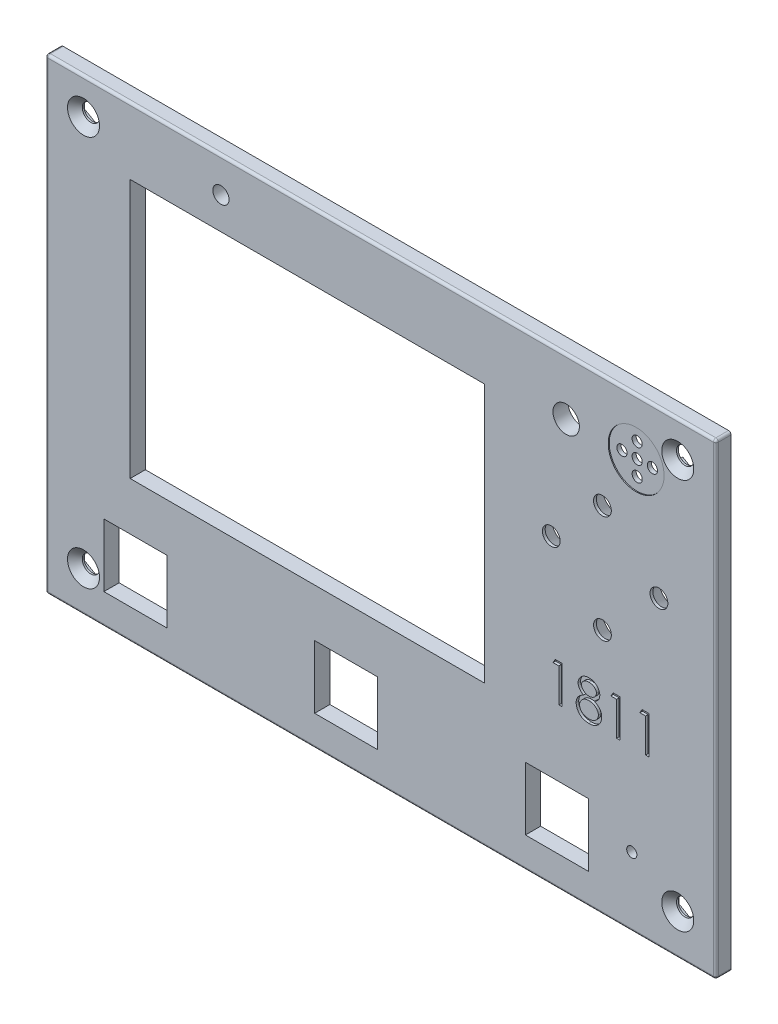
from build123d import *

# Parameters (mm, degrees)
ESQUISSE1_W                                 = 132
ESQUISSE1_H                                 = 92
BOSS_EXTRU_1_DEPTH                          = 3
ESQUISSE2_W                                 = 69.8
ESQUISSE2_H                                 = 51
ENL_V_MAT_EXTRU_1_DEPTH                     = 3
ESQUISSE3_W                                 = 12.4
ESQUISSE3_H                                 = 12.4
ENL_V_MAT_EXTRU_2_DEPTH                     = 3
ESQUISSE5_W                                 = 12.4
ESQUISSE5_H                                 = 12.4
ENL_V_MAT_EXTRU_3_DEPTH                     = 3
ESQUISSE7_R                                 = 1.75
ENL_V_MAT_EXTRU_5_DEPTH                     = 3
ESQUISSE6_W                                 = 12.4
ESQUISSE6_H                                 = 12.4
ENL_V_MAT_EXTRU_6_DEPTH                     = 3
ESQUISSE8_R                                 = 1.6
ENL_V_MAT_EXTRU_7_DEPTH                     = 3
ESQUISSE9_R                                 = 2.6
ENL_V_MAT_EXTRU_8_DEPTH                     = 3
ENL_V_MAT_EXTRU_9_DEPTH                     = 98.437468046
ENL_V_MAT_EXTRU_9_DEPTH_BACK                = 3
ESQUISSE10_R                                = 1
ESQUISSE12_R                                = 5.5
ENL_V_MAT_EXTRU_10_DEPTH                    = 0.2
CONG_1_R                                    = 0.5
CONG_2_R                                    = 0.5
CONG_3_R                                    = 0.5
CONG_4_R                                    = 0.5
ESQUISSE15_R                                = 1.7
ENL_V_MAT_EXTRU_11_DEPTH                    = 3
ESQUISSE20_R                                = 1
ENL_V_MAT_EXTRU_12_DEPTH                    = 3
ESQUISSE23_R                                = 6.5
ENL_V_MAT_EXTRU_13_DEPTH                    = 2
ENL_V_MAT_EXTRU_17_DEPTH                    = 0.5
ESQUISSE25_R                                = 3
ENL_V_MAT_EXTRU_18_DEPTH                    = 3
ENL_V_MAT_EXTRU_18_DRAFT                    = -27
ESQUISSE26_R                                = 3
ENL_V_MAT_EXTRU_19_DEPTH                    = 3
ENL_V_MAT_EXTRU_19_DRAFT                    = -27
ESQUISSE27_R                                = 3
ENL_V_MAT_EXTRU_20_DEPTH                    = 3
ENL_V_MAT_EXTRU_20_DRAFT                    = -27
ESQUISSE28_R                                = 3
ENL_V_MAT_EXTRU_21_DEPTH                    = 3
ENL_V_MAT_EXTRU_21_DRAFT                    = -27
FRAISAGE_POUR_VIS_T_TE_FRAIS_E_M32_AT_COUNT = 2
FRAISAGE_POUR_VIS_T_TE_FRAIS_E_M32_AT_PITCH = 77
FRAISAGE_POUR_VIS_T_TE_FRAIS_E_M32_2_COUNT  = 2
FRAISAGE_POUR_VIS_T_TE_FRAIS_E_M32_2_PITCH  = 140.064270962
FRAISAGE_POUR_VIS_T_TE_FRAIS_E_M32_3_COUNT  = 2
FRAISAGE_POUR_VIS_T_TE_FRAIS_E_M32_3_PITCH  = 117
ENL_V_MAT_EXTRU_22_DEPTH                    = 1.2
ENL_V_MAT_EXTRU_23_DEPTH                    = 1.2
ENL_V_MAT_EXTRU_24_DEPTH                    = 1.2
ENL_V_MAT_EXTRU_25_DEPTH                    = 1.2


with BuildPart() as part:
    # Esquisse1 → Boss.-Extru.1 (new body)
    with BuildSketch(Plane.XY):
        with Locations((13.801143929, 9.828645038)):
            Rectangle(ESQUISSE1_W, ESQUISSE1_H)
    extrude(amount=BOSS_EXTRU_1_DEPTH)

    # Esquisse2 → Enlèv. mat.-Extru.1 (cut)
    with BuildSketch(Plane.XY.offset(3)):
        with Locations((-0.618856071, 17.228645038)):
            Rectangle(ESQUISSE2_W, ESQUISSE2_H)
    extrude(amount=-ENL_V_MAT_EXTRU_1_DEPTH, mode=Mode.SUBTRACT)

    # Esquisse3 → Enlèv. mat.-Extru.2 (cut)
    with BuildSketch(Plane.XY.offset(3)):
        with Locations((-34.488856071, -23.941354962)):
            Rectangle(ESQUISSE3_W, ESQUISSE3_H)
    extrude(amount=-ENL_V_MAT_EXTRU_2_DEPTH, mode=Mode.SUBTRACT)

    # Esquisse5 → Enlèv. mat.-Extru.3 (cut)
    with BuildSketch(Plane.XY.offset(3)):
        with Locations((7.011143929, -23.941354962)):
            Rectangle(ESQUISSE5_W, ESQUISSE5_H)
    extrude(amount=-ENL_V_MAT_EXTRU_3_DEPTH, mode=Mode.SUBTRACT)

    # Esquisse7 → Enlèv. mat.-Extru.5 (cut)
    with BuildSketch(Plane.XY.offset(3)):
        with Locations((57.471143929, 12.398645038)):
            Circle(ESQUISSE7_R)
        with Locations((68.601143929, 23.368645038)):
            Circle(ESQUISSE7_R)
        with Locations((57.471143929, 33.598645038)):
            Circle(ESQUISSE7_R)
        with Locations((47.401143929, 23.368645038)):
            Circle(ESQUISSE7_R)
    extrude(amount=-ENL_V_MAT_EXTRU_5_DEPTH, mode=Mode.SUBTRACT)

    # Esquisse6 → Enlèv. mat.-Extru.6 (cut)
    with BuildSketch(Plane.XY.offset(3)):
        with Locations((48.511143929, -23.941354962)):
            Rectangle(ESQUISSE6_W, ESQUISSE6_H)
    extrude(amount=-ENL_V_MAT_EXTRU_6_DEPTH, mode=Mode.SUBTRACT)

    # Esquisse8 → Enlèv. mat.-Extru.7 (cut)
    with BuildSketch(Plane.XY.offset(3)):
        with Locations((-17.648856071, 49.018645038)):
            Circle(ESQUISSE8_R)
    extrude(amount=-ENL_V_MAT_EXTRU_7_DEPTH, mode=Mode.SUBTRACT)

    # Esquisse9 → Enlèv. mat.-Extru.8 (cut)
    with BuildSketch(Plane.XY.offset(3)):
        with Locations((50.331143929, 44.768645038)):
            Circle(ESQUISSE9_R)
    extrude(amount=-ENL_V_MAT_EXTRU_8_DEPTH, mode=Mode.SUBTRACT)

    # Esquisse10 → Enlèv. mat.-Extru.9 (cut, two sides: drawn at the far end of the back side and taken through both)
    with BuildSketch(Plane.XY.offset(3).offset(-ENL_V_MAT_EXTRU_9_DEPTH_BACK)):
        with Locations(Location((64.111143929, 44.768645038, 0), (0, 0, 180))):
            Circle(ESQUISSE10_R)
        with Locations(Location((64.111143929, 47.768645038, 0), (0, 0, 180))):
            Circle(ESQUISSE10_R)
        with Locations(Location((64.111143929, 41.768645038, 0), (0, 0, 180))):
            Circle(ESQUISSE10_R)
        with Locations(Location((61.111143929, 44.768645038, 0), (0, 0, 180))):
            Circle(ESQUISSE10_R)
        with Locations(Location((67.111143929, 44.768645038, 0), (0, 0, 180))):
            Circle(ESQUISSE10_R)
    extrude(amount=ENL_V_MAT_EXTRU_9_DEPTH + ENL_V_MAT_EXTRU_9_DEPTH_BACK, mode=Mode.SUBTRACT)

    # Esquisse12 → Enlèv. mat.-Extru.10 (cut)
    with BuildSketch(Plane.XY.offset(3)):
        with Locations((64.111143929, 44.768645038)):
            Circle(ESQUISSE12_R)
    extrude(amount=-ENL_V_MAT_EXTRU_10_DEPTH, mode=Mode.SUBTRACT)

    # Congé1
    cong_1_edges = [part.edges().sort_by_distance(p)[0] for p in [
        (-52.198856071, 9.828645038, 3),
    ]]
    fillet(cong_1_edges, radius=CONG_1_R)

    # Congé2
    cong_2_edges = [part.edges().sort_by_distance(p)[0] for p in [
        (14.051143929, -36.171354962, 3),
        (-52.198856071, -36.171354962, 1.25),
        (-52.052409461, -36.171354962, 2.853553391),
    ]]
    fillet(cong_2_edges, radius=CONG_2_R)

    # Congé3
    cong_3_edges = [part.edges().sort_by_distance(p)[0] for p in [
        (79.801143929, -36.171354962, 1.25),
        (79.801143929, 10.078645038, 3),
        (79.801143929, -36.024908352, 2.853553391),
    ]]
    fillet(cong_3_edges, radius=CONG_3_R)

    # Congé4
    cong_4_edges = [part.edges().sort_by_distance(p)[0] for p in [
        (-52.198856071, 55.828645038, 1.25),
        (-52.052409461, 55.828645038, 2.853553391),
        (79.801143929, 55.828645038, 1.25),
        (13.801143929, 55.828645038, 3),
        (79.65469732, 55.828645038, 2.853553391),
    ]]
    fillet(cong_4_edges, radius=CONG_4_R)

    # Esquisse15 → Enlèv. mat.-Extru.11 (cut)
    with BuildSketch(Plane.XY.offset(3)):
        with Locations((-44.698856071, 48.828645038)):
            Circle(ESQUISSE15_R)
        with Locations((72.301143929, 48.828645038)):
            Circle(ESQUISSE15_R)
        with Locations((-44.698856071, -28.171354962)):
            Circle(ESQUISSE15_R)
        with Locations((72.301143929, -28.171354962)):
            Circle(ESQUISSE15_R)
    extrude(amount=-ENL_V_MAT_EXTRU_11_DEPTH, mode=Mode.SUBTRACT)

    # Esquisse20 → Enlèv. mat.-Extru.12 (cut)
    with BuildSketch(Plane.XY.offset(3)):
        with Locations((63.251143929, -22.583354962)):
            Circle(ESQUISSE20_R)
    extrude(amount=-ENL_V_MAT_EXTRU_12_DEPTH, mode=Mode.SUBTRACT)

    # Esquisse23 → Enlèv. mat.-Extru.13 (cut)
    with BuildSketch(Plane(origin=(0, 0, 0), x_dir=(-1, 0, 0), z_dir=(0, 0, -1))):
        with Locations((-64.111143929, 44.768645038)):
            Circle(ESQUISSE23_R)
    extrude(amount=-ENL_V_MAT_EXTRU_13_DEPTH, mode=Mode.SUBTRACT)

    # Esquisse24 → Enlèv. mat.-Extru.17 (cut)
    # profile 1 of 4: a face of its own
    with BuildSketch(Plane.XY.offset(3)):
        Polygon((48.176182968, 2.733677062), (49.545952933, 2.733677062), (49.545952933, -4.674656271), (48.881102506, -4.674656271), (48.881102506, 1.973848002), (47.741358916, 1.973848002), align=None)
    # profile 2 of 4: a face of its own
    with BuildSketch(Plane.XY.offset(3)):
        with BuildLine():
            add(Edge.make_bspline(
                [(55.902101104, -0.547537882), (55.962740529, -0.579156555), (56.081007658, -0.640823528), (56.249446082, -0.740118113), (56.403380668, -0.844768156), (56.547082358, -0.949830725), (56.67802645, -1.059329387), (56.794748791, -1.173699568), (56.900132586, -1.290086485), (56.992052612, -1.41046098), (57.072902583, -1.534503254), (57.14277827, -1.662538882), (57.202504682, -1.794287272), (57.249839569, -1.931186562), (57.288832362, -2.071225782), (57.315662392, -2.216213177), (57.330091535, -2.365193366), (57.332819523, -2.465879604), (57.334200797, -2.516860465)],
                knots=[0, 0, 0, 0, 1.272397273, 2.481599622, 3.635517121, 4.734568067, 5.792894095, 6.808321871, 7.773003508, 8.711915296, 9.623354172, 10.525449501, 11.423591555, 12.311487226, 13.218079475, 14.126165749, 15.051214107, 16, 16, 16, 16], degree=3))
            add(Edge.make_bspline(
                [(57.334200797, -2.516860465), (57.332567956, -2.588187332), (57.329335953, -2.729369966), (57.30118432, -2.937747568), (57.259035182, -3.14012584), (57.197483548, -3.336460412), (57.117656871, -3.525667919), (57.019280901, -3.707910323), (56.907920517, -3.886174527), (56.818486611, -3.995858928), (56.773233248, -4.051358996)],
                knots=[0, 0, 0, 0, 1.025265484, 2.029385089, 3.018602448, 3.995076438, 4.983346944, 5.966715145, 6.97116228, 8, 8, 8, 8], degree=3))
            add(Edge.make_bspline(
                [(56.773233248, -4.051358996), (56.714312711, -4.116115818), (56.597199734, -4.244829244), (56.396575871, -4.411941792), (56.176396217, -4.552381342), (55.937512746, -4.666833519), (55.680564014, -4.755915254), (55.405604771, -4.819928584), (55.112098981, -4.856594392), (54.910369067, -4.861894504), (54.806878748, -4.864613536)],
                knots=[0, 0, 0, 0, 0.954267603, 1.896743057, 2.838368354, 3.796610408, 4.779680527, 5.799409237, 6.871065594, 8, 8, 8, 8], degree=3))
            add(Edge.make_bspline(
                [(54.806878748, -4.864613536), (54.707367075, -4.862174125), (54.513727468, -4.857427277), (54.231876627, -4.82526573), (53.969149463, -4.768903413), (53.724018363, -4.691762323), (53.497961129, -4.591410673), (53.291621898, -4.466509541), (53.102023657, -4.322086322), (52.934920288, -4.15399319), (52.786566415, -3.973954027), (52.656247369, -3.788213119), (52.547928903, -3.596753512), (52.456219885, -3.402430035), (52.386014237, -3.202519009), (52.337389725, -2.998048981), (52.30650901, -2.789377096), (52.302400275, -2.648551763), (52.300333275, -2.577706151)],
                knots=[0, 0, 0, 0, 1.256902934, 2.445805442, 3.576955095, 4.645999104, 5.686449165, 6.692658513, 7.68621702, 8.689161843, 9.678783111, 10.630372946, 11.551080876, 12.453998257, 13.34127905, 14.221779781, 15.105423033, 16, 16, 16, 16], degree=3))
            add(Edge.make_bspline(
                [(52.300333275, -2.577706151), (52.301556457, -2.525722528), (52.303973895, -2.422984541), (52.320705824, -2.271199796), (52.3476054, -2.123464644), (52.384137917, -1.979233403), (52.433648923, -1.839556109), (52.493428105, -1.70377094), (52.563134071, -1.571724597), (52.643739204, -1.442694966), (52.737511821, -1.318489998), (52.843691547, -1.19700181), (52.964400535, -1.080115524), (53.098295913, -0.966403058), (53.243847522, -0.853847247), (53.404835961, -0.748530955), (53.576993495, -0.642998263), (53.69934827, -0.579903974), (53.762113791, -0.547537882)],
                knots=[0, 0, 0, 0, 0.941657376, 1.861047343, 2.762797495, 3.66048619, 4.553285746, 5.444104102, 6.34607688, 7.256116206, 8.197091036, 9.162375105, 10.176350973, 11.237807142, 12.343728897, 13.50695164, 14.721116704, 16, 16, 16, 16], degree=3))
            add(Edge.make_bspline(
                [(53.762113791, -0.547537882), (53.676195381, -0.500685955), (53.509833291, -0.409967511), (53.289552974, -0.243286771), (53.100342821, -0.062760896), (52.947403669, 0.135422169), (52.827024119, 0.345071387), (52.74443474, 0.564875054), (52.688562182, 0.790757494), (52.683027465, 0.94507561), (52.680247805, 1.022577636)],
                knots=[0, 0, 0, 0, 1.166880483, 2.259407225, 3.286803203, 4.280235371, 5.237608625, 6.161067461, 7.076446754, 8, 8, 8, 8], degree=3))
            add(Edge.make_bspline(
                [(52.680247805, 1.022577636), (52.683709453, 1.101524135), (52.690667968, 1.260220365), (52.746935997, 1.496453326), (52.838630138, 1.728475055), (52.963346248, 1.955160981), (53.118682522, 2.168838935), (53.305047711, 2.360483938), (53.517991356, 2.528359909), (53.756450508, 2.669279475), (54.013067207, 2.783968219), (54.283822155, 2.863085881), (54.563997899, 2.914808995), (54.754704739, 2.92066508), (54.851399982, 2.923634327)],
                knots=[0, 0, 0, 0, 0.888701115, 1.786444228, 2.72001202, 3.692817113, 4.693886446, 5.687152267, 6.695133018, 7.739871481, 8.800368666, 9.853104506, 10.91144658, 12, 12, 12, 12], degree=3))
            add(Edge.make_bspline(
                [(54.851399982, 2.923634327), (54.945599724, 2.920572901), (55.131350883, 2.914536117), (55.404389511, 2.864187225), (55.665638835, 2.780093075), (55.914197941, 2.666010619), (56.145617061, 2.525491594), (56.350091949, 2.355309744), (56.53071258, 2.164510128), (56.680116215, 1.950896968), (56.803227664, 1.725082091), (56.888954572, 1.488814422), (56.94388625, 1.247198914), (56.950814871, 1.083711806), (56.954286267, 1.00180106)],
                knots=[0, 0, 0, 0, 1.072916533, 2.115669174, 3.151510826, 4.193348718, 5.225979165, 6.227137561, 7.216255879, 8.211077061, 9.189680878, 10.138522389, 11.067357538, 12, 12, 12, 12], degree=3))
            add(Edge.make_bspline(
                [(56.954286267, 1.00180106), (56.95124978, 0.921417122), (56.945286293, 0.763547635), (56.895121421, 0.533409834), (56.81063824, 0.317886518), (56.695292262, 0.114532103), (56.54495498, -0.072965401), (56.361633162, -0.246990262), (56.146788366, -0.408972049), (55.98536949, -0.500383186), (55.902101104, -0.547537882)],
                knots=[0, 0, 0, 0, 0.975232327, 1.915300861, 2.843280834, 3.77672583, 4.742871857, 5.749627742, 6.839139064, 8, 8, 8, 8], degree=3))
        make_face()
        with BuildLine():
            add(Edge.make_bspline(
                [(54.814298954, 2.163805267), (54.762333081, 2.162426385), (54.660665113, 2.159728688), (54.511591092, 2.145634573), (54.369832915, 2.11821693), (54.23390947, 2.081728324), (54.105684317, 2.032435416), (53.98341601, 1.974449313), (53.869185458, 1.903951474), (53.7616137, 1.824870272), (53.664774561, 1.737890288), (53.57882826, 1.647267916), (53.507437085, 1.551223336), (53.446813403, 1.452145642), (53.402825858, 1.347094255), (53.369881415, 1.239289932), (53.347611136, 1.127370369), (53.345942377, 1.050881422), (53.345098232, 1.012189348)],
                knots=[0, 0, 0, 0, 1.203892937, 2.355340988, 3.463153438, 4.544400666, 5.610487187, 6.640501085, 7.674077295, 8.714426146, 9.728707835, 10.68524104, 11.601827946, 12.495867327, 13.368432065, 14.231010473, 15.105153427, 16, 16, 16, 16], degree=3))
            add(Edge.make_bspline(
                [(53.345098232, 1.012189348), (53.346553159, 0.973495603), (53.349428303, 0.897031204), (53.371664157, 0.784115788), (53.4048045, 0.673156657), (53.456981733, 0.566792228), (53.519563859, 0.461332785), (53.59680415, 0.359414044), (53.688855925, 0.260681313), (53.792630674, 0.165974362), (53.905685096, 0.077288647), (54.025454654, 0.000298746), (54.150436182, -0.064120121), (54.279345562, -0.117734028), (54.413496609, -0.159411062), (54.552067311, -0.18897803), (54.695080958, -0.207354923), (54.791983187, -0.209549952), (54.841011694, -0.210660545)],
                knots=[0, 0, 0, 0, 0.873023192, 1.725219244, 2.590779336, 3.480155217, 4.391973325, 5.357036234, 6.360879153, 7.436073238, 8.526419356, 9.601555421, 10.645666583, 11.697338044, 12.750135903, 13.812665442, 14.89329948, 16, 16, 16, 16], degree=3))
            add(Edge.make_bspline(
                [(54.841011694, -0.210660545), (54.903982747, -0.208812976), (55.029302892, -0.205136087), (55.214044144, -0.170949436), (55.393670074, -0.117173577), (55.566260755, -0.043598315), (55.727348794, 0.048747322), (55.870943605, 0.15930721), (55.995820362, 0.285528483), (56.10068132, 0.425446152), (56.181982162, 0.574357014), (56.245274322, 0.7237943), (56.282233894, 0.875352356), (56.287054744, 0.976882429), (56.289435839, 1.02702976)],
                knots=[0, 0, 0, 0, 1.076279235, 2.141928126, 3.20205304, 4.278698113, 5.344010996, 6.36967002, 7.368914609, 8.37248503, 9.349703398, 10.264243087, 11.142681841, 12, 12, 12, 12], degree=3))
            add(Edge.make_bspline(
                [(56.289435839, 1.02702976), (56.288309989, 1.062225769), (56.286075339, 1.132084803), (56.26766022, 1.235247676), (56.237231374, 1.336063628), (56.196034521, 1.435365501), (56.141827122, 1.53176005), (56.077556259, 1.626762587), (55.999484064, 1.718235953), (55.911861613, 1.808311865), (55.812493832, 1.891674715), (55.701572217, 1.964984851), (55.579665446, 2.027241006), (55.446770635, 2.077805537), (55.303377212, 2.11578351), (55.150145628, 2.14422378), (54.985798215, 2.160253532), (54.872705242, 2.162595678), (54.814298954, 2.163805267)],
                knots=[0, 0, 0, 0, 0.814439003, 1.616544685, 2.417341072, 3.248991801, 4.09997495, 4.973547432, 5.9003056, 6.880240646, 7.880314356, 8.896779544, 9.951930927, 11.043077905, 12.18215768, 13.381699519, 14.647792085, 16, 16, 16, 16], degree=3))
        make_face(mode=Mode.SUBTRACT)
        with BuildLine():
            add(Edge.make_bspline(
                [(54.857336146, -0.970489605), (54.791453234, -0.971661479), (54.662207035, -0.97396041), (54.472856537, -0.999549853), (54.291134003, -1.035172068), (54.117652137, -1.089212343), (53.952484199, -1.159478247), (53.794736054, -1.244006357), (53.645614497, -1.343924545), (53.507178726, -1.457963381), (53.380764345, -1.580855892), (53.26985461, -1.710950745), (53.175668192, -1.845830106), (53.099821144, -1.987206991), (53.037566312, -2.132087767), (52.996685271, -2.284080511), (52.970477315, -2.440263234), (52.966958078, -2.546435442), (52.965183703, -2.599966768)],
                knots=[0, 0, 0, 0, 1.140299081, 2.23698856, 3.303958914, 4.344563908, 5.37730929, 6.408454204, 7.439741482, 8.480804886, 9.510774543, 10.48932336, 11.43758569, 12.353841022, 13.263987381, 14.161954604, 15.073269652, 16, 16, 16, 16], degree=3))
            add(Edge.make_bspline(
                [(52.965183703, -2.599966768), (52.968069267, -2.666495519), (52.973794159, -2.798487008), (53.019210711, -2.993565508), (53.092099262, -3.182416741), (53.193752635, -3.363501708), (53.319625664, -3.532729433), (53.474410021, -3.680237341), (53.648486461, -3.811304471), (53.847744919, -3.917308267), (54.065398505, -4.001964043), (54.301389331, -4.060290831), (54.552330576, -4.0989019), (54.725600046, -4.102792716), (54.814298954, -4.104784476)],
                knots=[0, 0, 0, 0, 0.898778495, 1.783155532, 2.693654817, 3.627872908, 4.583023416, 5.533784346, 6.509005473, 7.520592997, 8.575161974, 9.658835044, 10.801527049, 12, 12, 12, 12], degree=3))
            add(Edge.make_bspline(
                [(54.814298954, -4.104784476), (54.883620566, -4.103453499), (55.018681296, -4.100860327), (55.215713221, -4.077970071), (55.401650849, -4.041670032), (55.576133606, -3.98887286), (55.741114733, -3.924420409), (55.893796999, -3.84150617), (56.038108215, -3.747203753), (56.166937275, -3.635320655), (56.2842709, -3.515772391), (56.386576369, -3.3892168), (56.475386519, -3.259093378), (56.545090375, -3.122461519), (56.600814279, -2.98194255), (56.640869137, -2.836240718), (56.665583792, -2.684909141), (56.668083355, -2.582252774), (56.669350369, -2.530216835)],
                knots=[0, 0, 0, 0, 1.224942928, 2.386581632, 3.501229538, 4.569074225, 5.605009692, 6.626002462, 7.634866581, 8.645888296, 9.63523824, 10.59253846, 11.518950513, 12.414518923, 13.29783783, 14.186679152, 15.080837789, 16, 16, 16, 16], degree=3))
            add(Edge.make_bspline(
                [(56.669350369, -2.530216835), (56.66743299, -2.479676464), (56.663652253, -2.380019681), (56.639656256, -2.2323472), (56.597500983, -2.08967791), (56.539657993, -1.950295397), (56.462651622, -1.817023818), (56.371963313, -1.686391255), (56.262544096, -1.562023448), (56.1389041, -1.442954394), (56.0041593, -1.332854418), (55.86093051, -1.23545719), (55.710320232, -1.153431877), (55.552647169, -1.086721962), (55.388261426, -1.034255151), (55.217283911, -0.997602961), (55.039514445, -0.974532135), (54.918748301, -0.971852338), (54.857336146, -0.970489605)],
                knots=[0, 0, 0, 0, 0.917430815, 1.809013306, 2.70690318, 3.612392954, 4.541220862, 5.495268465, 6.494511384, 7.542276156, 8.608045339, 9.649016899, 10.681629292, 11.715607085, 12.752076957, 13.808767841, 14.885711793, 16, 16, 16, 16], degree=3))
        make_face(mode=Mode.SUBTRACT)
    # profile 3 of 4: a face of its own
    with BuildSketch(Plane.XY.offset(3)):
        Polygon((59.573618865, 2.733677062), (60.943388831, 2.733677062), (60.943388831, -4.674656271), (60.278538403, -4.674656271), (60.278538403, 1.973848002), (59.138794814, 1.973848002), align=None)
    # profile 4 of 4: a face of its own
    with BuildSketch(Plane.XY.offset(3)):
        Polygon((65.272336814, 2.733677062), (66.642106779, 2.733677062), (66.642106779, -4.674656271), (65.977256352, -4.674656271), (65.977256352, 1.973848002), (64.837512762, 1.973848002), align=None)
    extrude(amount=-ENL_V_MAT_EXTRU_17_DEPTH, mode=Mode.SUBTRACT)


with BuildPart() as enl_v_mat_extru_18_tool:
    # Esquisse25 → Enlèv. mat.-Extru.18 (with draft: the straight prism first)
    with BuildSketch(Plane(origin=(0, 0, 0), x_dir=(-1, 0, 0), z_dir=(0, 0, -1))):
        with Locations((-47.401143929, 23.368645038)):
            Circle(ESQUISSE25_R)
    extrude(amount=-ENL_V_MAT_EXTRU_18_DEPTH)
    # Enlèv. mat.-Extru.18: the draft: its side faces are tilted about the plane it starts from
    enl_v_mat_extru_18_sides = [enl_v_mat_extru_18_tool.faces().sort_by_distance(p)[0] for p in [
        (50.401143929, 23.368645038, 1.5),
    ]]
    draft(enl_v_mat_extru_18_sides, Plane(origin=(0, 0, 0), x_dir=(-1, 0, 0), z_dir=(0, 0, -1)), ENL_V_MAT_EXTRU_18_DRAFT)


with BuildPart() as part_1:
    add(part.part)

    # Enlèv. mat.-Extru.18: cut by enl_v_mat_extru_18_tool
    add(enl_v_mat_extru_18_tool.part, mode=Mode.SUBTRACT)


with BuildPart() as enl_v_mat_extru_19_tool:
    # Esquisse26 → Enlèv. mat.-Extru.19 (with draft: the straight prism first)
    with BuildSketch(Plane(origin=(0, 0, 0), x_dir=(-1, 0, 0), z_dir=(0, 0, -1))):
        with Locations((-57.471143929, 12.398645038)):
            Circle(ESQUISSE26_R)
    extrude(amount=-ENL_V_MAT_EXTRU_19_DEPTH)
    # Enlèv. mat.-Extru.19: the draft: its side faces are tilted about the plane it starts from
    enl_v_mat_extru_19_sides = [enl_v_mat_extru_19_tool.faces().sort_by_distance(p)[0] for p in [
        (60.471143929, 12.398645038, 1.5),
    ]]
    draft(enl_v_mat_extru_19_sides, Plane(origin=(0, 0, 0), x_dir=(-1, 0, 0), z_dir=(0, 0, -1)), ENL_V_MAT_EXTRU_19_DRAFT)


with BuildPart() as part_2:
    add(part_1.part)

    # Enlèv. mat.-Extru.19: cut by enl_v_mat_extru_19_tool
    add(enl_v_mat_extru_19_tool.part, mode=Mode.SUBTRACT)


with BuildPart() as enl_v_mat_extru_20_tool:
    # Esquisse27 → Enlèv. mat.-Extru.20 (with draft: the straight prism first)
    with BuildSketch(Plane(origin=(0, 0, 0), x_dir=(-1, 0, 0), z_dir=(0, 0, -1))):
        with Locations((-68.601143929, 23.368645038)):
            Circle(ESQUISSE27_R)
    extrude(amount=-ENL_V_MAT_EXTRU_20_DEPTH)
    # Enlèv. mat.-Extru.20: the draft: its side faces are tilted about the plane it starts from
    enl_v_mat_extru_20_sides = [enl_v_mat_extru_20_tool.faces().sort_by_distance(p)[0] for p in [
        (71.601143929, 23.368645038, 1.5),
    ]]
    draft(enl_v_mat_extru_20_sides, Plane(origin=(0, 0, 0), x_dir=(-1, 0, 0), z_dir=(0, 0, -1)), ENL_V_MAT_EXTRU_20_DRAFT)


with BuildPart() as part_3:
    add(part_2.part)

    # Enlèv. mat.-Extru.20: cut by enl_v_mat_extru_20_tool
    add(enl_v_mat_extru_20_tool.part, mode=Mode.SUBTRACT)


with BuildPart() as enl_v_mat_extru_21_tool:
    # Esquisse28 → Enlèv. mat.-Extru.21 (with draft: the straight prism first)
    with BuildSketch(Plane(origin=(0, 0, 0), x_dir=(-1, 0, 0), z_dir=(0, 0, -1))):
        with Locations((-57.471143929, 33.598645038)):
            Circle(ESQUISSE28_R)
    extrude(amount=-ENL_V_MAT_EXTRU_21_DEPTH)
    # Enlèv. mat.-Extru.21: the draft: its side faces are tilted about the plane it starts from
    enl_v_mat_extru_21_sides = [enl_v_mat_extru_21_tool.faces().sort_by_distance(p)[0] for p in [
        (60.471143929, 33.598645038, 1.5),
    ]]
    draft(enl_v_mat_extru_21_sides, Plane(origin=(0, 0, 0), x_dir=(-1, 0, 0), z_dir=(0, 0, -1)), ENL_V_MAT_EXTRU_21_DRAFT)


with BuildPart() as part_4:
    add(part_3.part)

    # Enlèv. mat.-Extru.21: cut by enl_v_mat_extru_21_tool
    add(enl_v_mat_extru_21_tool.part, mode=Mode.SUBTRACT)

    # Esquisse32 → Fraisage pour vis à tête fraisée M32 (revolve, cut)
    with BuildSketch(Plane(origin=(-44.698856071, 48.828645038, 3), x_dir=(0, -1, 0), z_dir=(1, 0, 0))):
        Polygon((0, 0), (0, 3), (1.7, 3), (1.7, 1.45), (3.15, 0), align=None)
    fraisage_pour_vis_t_te_frais_e_m32 = revolve(axis=Axis((-44.698856071, 48.828645038, 9.35), (0, 0, -1)), mode=Mode.SUBTRACT)

    # Fraisage pour vis à tête fraisée M32 at: Fraisage pour vis à tête fraisée M32 ×2
    with Locations(*[(0, -i * FRAISAGE_POUR_VIS_T_TE_FRAIS_E_M32_AT_PITCH, 0) for i in range(1, FRAISAGE_POUR_VIS_T_TE_FRAIS_E_M32_AT_COUNT)]):
        add(fraisage_pour_vis_t_te_frais_e_m32, mode=Mode.SUBTRACT)

    # Fraisage pour vis _ t_te frais_e M32 2: Fraisage pour vis à tête fraisée M32 ×2
    with Locations(*[Vector(0.8353308034715732, -0.5497476227975308, 0) * (i * FRAISAGE_POUR_VIS_T_TE_FRAIS_E_M32_2_PITCH) for i in range(1, FRAISAGE_POUR_VIS_T_TE_FRAIS_E_M32_2_COUNT)]):
        add(fraisage_pour_vis_t_te_frais_e_m32, mode=Mode.SUBTRACT)

    # Fraisage pour vis _ t_te frais_e M32 3: Fraisage pour vis à tête fraisée M32 ×2
    with Locations(*[(i * FRAISAGE_POUR_VIS_T_TE_FRAIS_E_M32_3_PITCH, 0, 0) for i in range(1, FRAISAGE_POUR_VIS_T_TE_FRAIS_E_M32_3_COUNT)]):
        add(fraisage_pour_vis_t_te_frais_e_m32, mode=Mode.SUBTRACT)

    # Esquisse33 → Enlèv. mat.-Extru.22 (cut)
    with BuildSketch(Plane(origin=(0, 0, 0), x_dir=(-1, 0, 0), z_dir=(0, 0, -1))):
        Polygon((44.698856071, -24.971354962), (41.927574779, -26.571354962), (41.927574779, -29.771354962), (44.698856071, -31.371354962), (47.470137363, -29.771354962), (47.470137363, -26.571354962), align=None)
    extrude(amount=-ENL_V_MAT_EXTRU_22_DEPTH, mode=Mode.SUBTRACT)

    # Esquisse34 → Enlèv. mat.-Extru.23 (cut)
    with BuildSketch(Plane(origin=(0, 0, 0), x_dir=(-1, 0, 0), z_dir=(0, 0, -1))):
        Polygon((44.698856071, 52.028645038), (41.927574779, 50.428645038), (41.927574779, 47.228645038), (44.698856071, 45.628645038), (47.470137363, 47.228645038), (47.470137363, 50.428645038), align=None)
    extrude(amount=-ENL_V_MAT_EXTRU_23_DEPTH, mode=Mode.SUBTRACT)

    # Esquisse35 → Enlèv. mat.-Extru.24 (cut)
    with BuildSketch(Plane(origin=(0, 0, 0), x_dir=(-1, 0, 0), z_dir=(0, 0, -1))):
        Polygon((-72.301143929, 52.028645038), (-75.072425221, 50.428645038), (-75.072425221, 47.228645038), (-72.301143929, 45.628645038), (-69.529862637, 47.228645038), (-69.529862637, 50.428645038), align=None)
    extrude(amount=-ENL_V_MAT_EXTRU_24_DEPTH, mode=Mode.SUBTRACT)

    # Esquisse36 → Enlèv. mat.-Extru.25 (cut)
    with BuildSketch(Plane(origin=(0, 0, 0), x_dir=(-1, 0, 0), z_dir=(0, 0, -1))):
        Polygon((-72.301143929, -24.971354962), (-75.072425221, -26.571354962), (-75.072425221, -29.771354962), (-72.301143929, -31.371354962), (-69.529862637, -29.771354962), (-69.529862637, -26.571354962), align=None)
    extrude(amount=-ENL_V_MAT_EXTRU_25_DEPTH, mode=Mode.SUBTRACT)


solid = part_4.part
